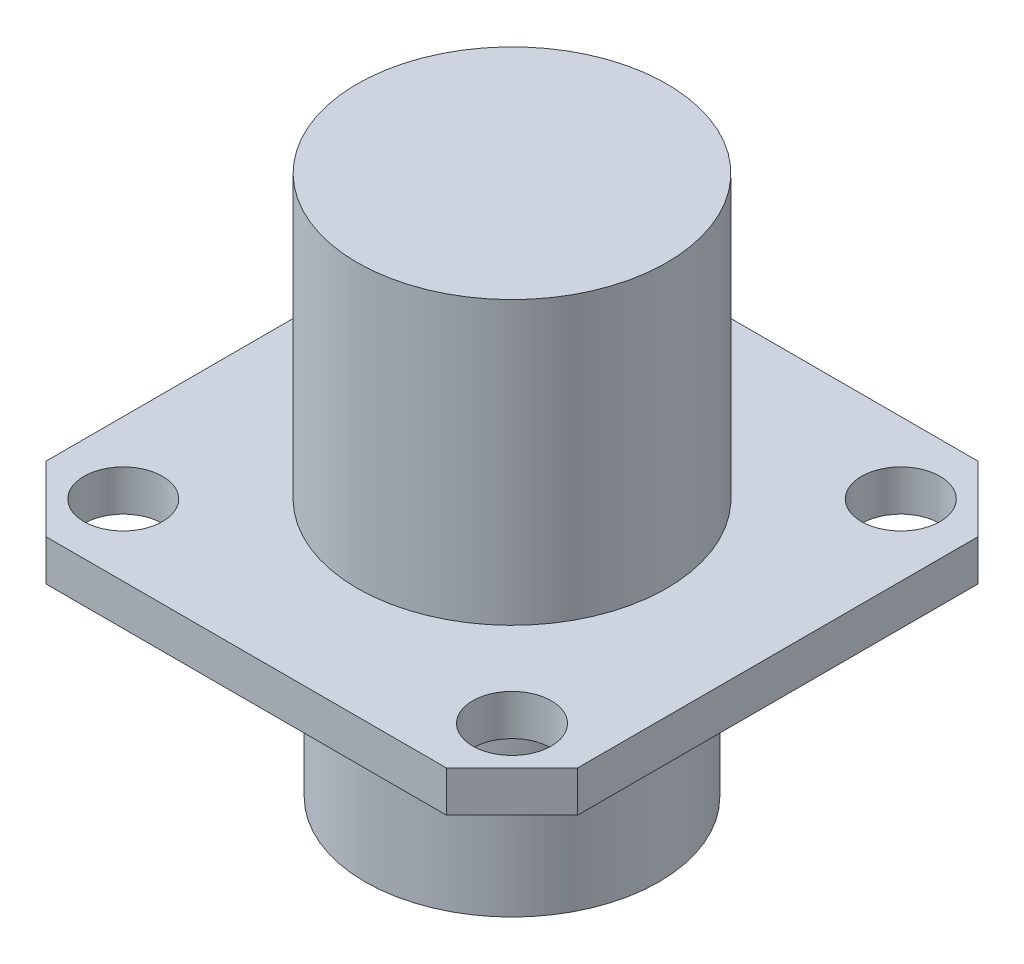
from build123d import *

# Parameters (mm, degrees)
SKETCH1_W           = 20.6248
SKETCH1_H           = 20.6248
BOSS_EXTRUDE1_DEPTH = 1.5875
CHAMFER1_SIZE       = 2.54
SKETCH2_R           = 1.524
CUT_EXTRUDE1_DEPTH  = 15.670083291
SKETCH3_R           = 6.0071
BOSS_EXTRUDE2_DEPTH = 10.9474
SKETCH4_R           = 5.7023
BOSS_EXTRUDE3_DEPTH = 8.4328


with BuildPart() as part:
    # Sketch1 → Boss-Extrude1 (new body)
    with BuildSketch(Plane(origin=(0, 0, 0), x_dir=(1, 0, 0), z_dir=(0, 1, 0))):
        Rectangle(SKETCH1_W, SKETCH1_H)
    extrude(amount=BOSS_EXTRUDE1_DEPTH)

    # Chamfer1
    chamfer1_edges = [part.edges().sort_by_distance(p)[0] for p in [
        (10.3124, 0.79375, 10.3124),
        (-10.3124, 0.79375, 10.3124),
        (-10.3124, 0.79375, -10.3124),
        (10.3124, 0.79375, -10.3124),
    ]]
    chamfer(chamfer1_edges, length=CHAMFER1_SIZE)

    # Sketch2 → Cut-Extrude1 (cut, through all)
    with BuildSketch(Plane(origin=(0, 1.5875, 0), x_dir=(1, 0, 0), z_dir=(0, 1, 0))):
        with Locations(Location((-7.5438, 7.5438, 0), (0, 0, 270))):
            Circle(SKETCH2_R)
        with Locations(Location((7.5438, 7.5438, 0), (0, 0, 270))):
            Circle(SKETCH2_R)
        with Locations(Location((7.5438, -7.5438, 0), (0, 0, 270))):
            Circle(SKETCH2_R)
        with Locations(Location((-7.5438, -7.5438, 0), (0, 0, 270))):
            Circle(SKETCH2_R)
    extrude(amount=-CUT_EXTRUDE1_DEPTH, mode=Mode.SUBTRACT)

    # Sketch3 → Boss-Extrude2 (add)
    with BuildSketch(Plane(origin=(0, 1.5875, 0), x_dir=(1, 0, 0), z_dir=(0, 1, 0))):
        with Locations(Location((0, 0, 0), (0, 0, 270))):
            Circle(SKETCH3_R)
    extrude(amount=BOSS_EXTRUDE2_DEPTH)

    # Sketch4 → Boss-Extrude3 (add)
    with BuildSketch(Plane.XZ):
        with Locations(Location((0, 0, 0), (0, 0, 90))):
            Circle(SKETCH4_R)
    extrude(amount=BOSS_EXTRUDE3_DEPTH)


solid = part.part
